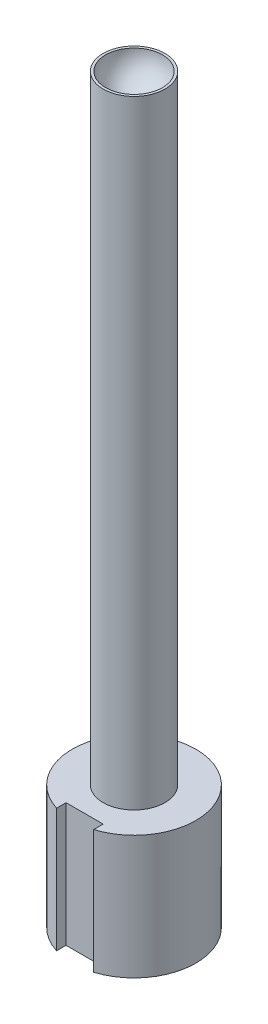
from build123d import *

# Parameters (mm, degrees)
SKETCH1_R                             = 5
BOSS_EXTRUDE1_DEPTH                   = 10
SKETCH2_R                             = 2.5
BOSS_EXTRUDE2_DEPTH                   = 50
SKETCH9_W                             = 3
SKETCH9_H                             = 1.420897346
CUT_EXTRUDE2_DEPTH                    = 10
TAP_DRILL_FOR_M3X0_5_TAP2_D           = 2.5
TAP_DRILL_FOR_M3X0_5_TAP2_DEPTH       = 5
TAP_DRILL_FOR_M3X0_5_TAP2_CSINK_D     = 2.55
TAP_DRILL_FOR_M3X0_5_TAP2_CSINK_ANGLE = 90
TAP_DRILL_FOR_M3X0_5_TAP2_TIP         = 0.751075774


with BuildPart() as part:
    # Sketch1 → Boss-Extrude1 (new body)
    with BuildSketch(Plane(origin=(0, 0, 0), x_dir=(1, 0, 0), z_dir=(0, 1, 0))):
        with Locations(Location((0, 0, 0), (0, 0, 270))):
            Circle(SKETCH1_R)
    extrude(amount=BOSS_EXTRUDE1_DEPTH)

    # Sketch2 → Boss-Extrude2 (add)
    with BuildSketch(Plane(origin=(0, 10, 0), x_dir=(1, 0, 0), z_dir=(0, 1, 0))):
        with Locations(Location((0, 0, 0), (0, 0, 270))):
            Circle(SKETCH2_R)
    extrude(amount=BOSS_EXTRUDE2_DEPTH)

    # Sketch7 → Cut-Revolve1 (revolve, cut)
    with BuildSketch(Plane.XY):
        with BuildLine():
            Line((2.3, 60), (0, 60))
            Line((0, 60), (0, 57.7))
            ThreePointArc((0, 57.7), (1.626345597, 58.373654403), (2.3, 60))
        make_face()
    revolve(axis=Axis((0, 60, 0), (0, -1, 0)), mode=Mode.SUBTRACT)

    # Sketch9 → Cut-Extrude2 (cut)
    with BuildSketch(Plane.XZ):
        with Locations((0, 4.710448673)):
            Rectangle(SKETCH9_W, SKETCH9_H)
    extrude(amount=-CUT_EXTRUDE2_DEPTH, mode=Mode.SUBTRACT)

    # Tap Drill for M3x0.5 Tap2
    with Locations(Plane.XZ):
        with Locations((0, 0)):
            CounterSinkHole(TAP_DRILL_FOR_M3X0_5_TAP2_D / 2, TAP_DRILL_FOR_M3X0_5_TAP2_CSINK_D / 2, depth=TAP_DRILL_FOR_M3X0_5_TAP2_DEPTH, counter_sink_angle=TAP_DRILL_FOR_M3X0_5_TAP2_CSINK_ANGLE)
            with Locations((0, 0, -(TAP_DRILL_FOR_M3X0_5_TAP2_DEPTH + TAP_DRILL_FOR_M3X0_5_TAP2_TIP / 2))):  # 118° drill point
                Cone(0, TAP_DRILL_FOR_M3X0_5_TAP2_D / 2, TAP_DRILL_FOR_M3X0_5_TAP2_TIP, mode=Mode.SUBTRACT)


solid = part.part
